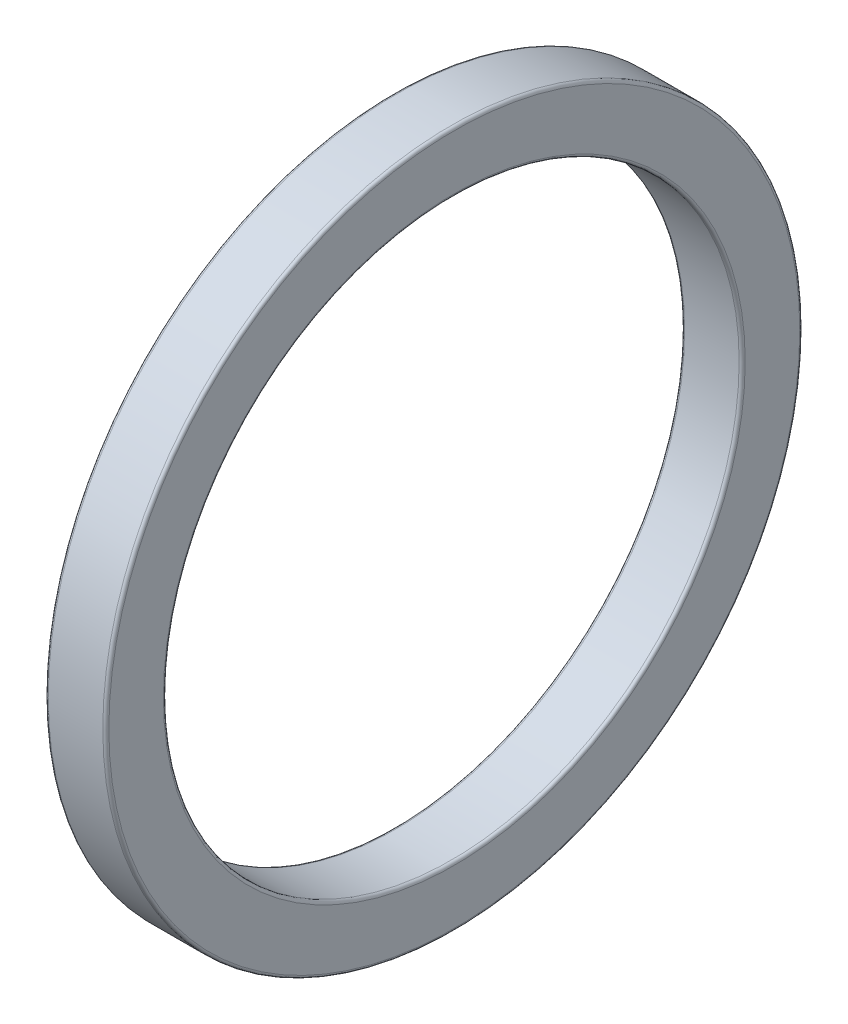
from build123d import *

# Parameters (mm, degrees)
SKETCH_1_W = 2
SKETCH_1_H = 2
FILLET_1_R = 0.1


with BuildPart() as part:
    # 草图1 → 旋转1 (revolve)
    with BuildSketch(Plane.XY, mode=Mode.PRIVATE) as revolve_1_sk:
        with Locations((-1, 10.5)):
            Rectangle(SKETCH_1_W, SKETCH_1_H)
    revolve(revolve_1_sk.sketch.rotate(Axis((-16.575757576, 0, 0), (1, 0, 0)), 90), axis=Axis((-16.575757576, 0, 0), (1, 0, 0)))

    # 圆角1
    fillet_1_edges = [part.edges().sort_by_distance(p)[0] for p in [
        (0, 0, -11.5),
        (-2, 0, -11.5),
        (-2, 0, -9.5),
        (0, 0, -9.5),
    ]]
    fillet(fillet_1_edges, radius=FILLET_1_R)


solid = part.part
